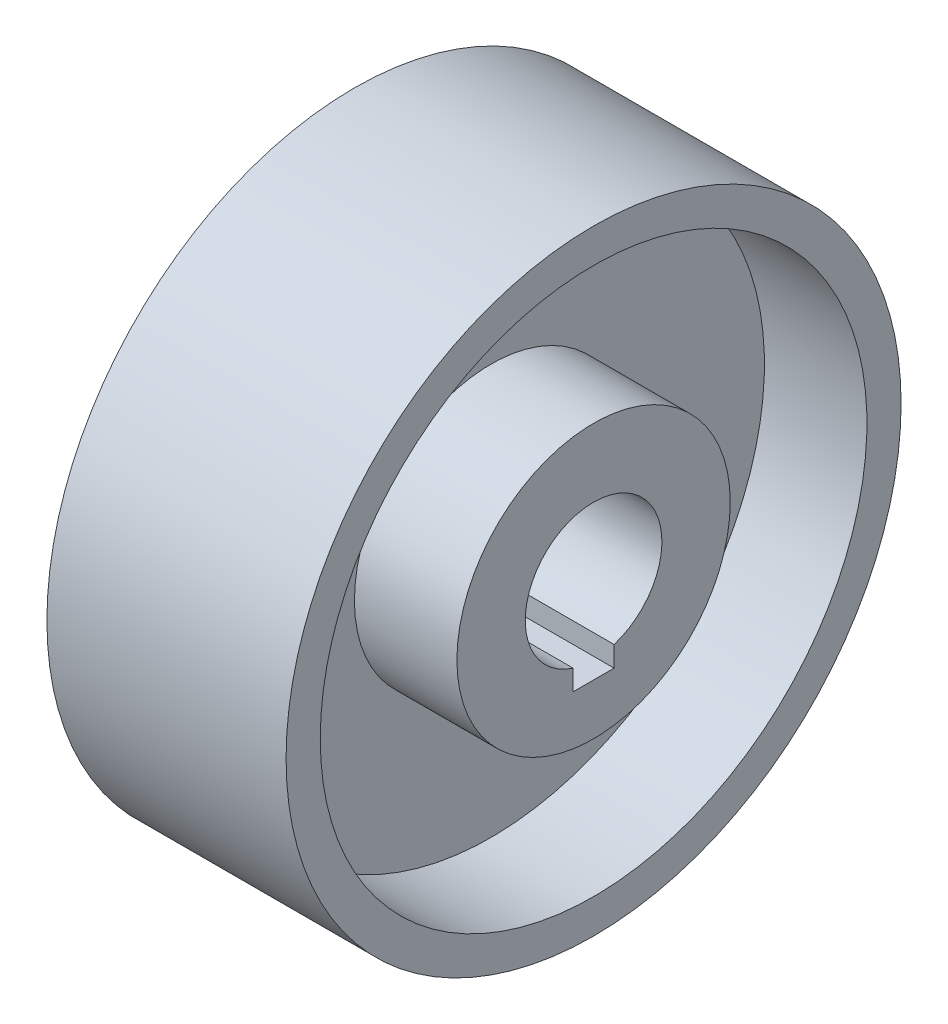
from build123d import *

# Parameters (mm, degrees)
CUT_EXTRUDE1_REACH = 74.629


with BuildPart() as part:
    # Sketch1 → Revolve1 (revolve)
    with BuildSketch(Plane(origin=(0, 0, 0), x_dir=(1, 0, 0), z_dir=(0, 1, 0)), mode=Mode.PRIVATE) as revolve1_sk:
        Polygon((-17.5, 45), (17.5, 45), (17.5, 40), (2.5, 40), (2.5, 20), (17.5, 20), (17.5, 10), (-17.5, 10), (-17.5, 20), (-2.5, 20), (-2.5, 40), (-17.5, 40), align=None)
    revolve(revolve1_sk.sketch.rotate(Axis((-42.069832926, 0, 0), (1, 0, 0)), 180), axis=Axis((-42.069832926, 0, 0), (1, 0, 0)))

    # Sketch2 → Cut-Extrude1 (cut, up to next)
    with BuildSketch(Plane(origin=(17.5, 0, 0), x_dir=(0, 0, -1), z_dir=(1, 0, 0)), mode=Mode.PRIVATE) as cut_extrude1_sk1:
        with BuildLine():
            Line((-3, -9.539392014), (-3, -12.539392014))
            Line((-3, -12.539392014), (3, -12.539392014))
            Line((3, -12.539392014), (3, -9.539392014))
            ThreePointArc((3, -9.539392014), (0, -10), (-3, -9.539392014))
        make_face()
    cut_extrude1_tool1 = extrude(cut_extrude1_sk1.sketch, amount=-CUT_EXTRUDE1_REACH, mode=Mode.PRIVATE) & part.part
    add(cut_extrude1_tool1.solids().sort_by_distance((17.5, -11.19017, 0))[0], mode=Mode.SUBTRACT)


solid = part.part
